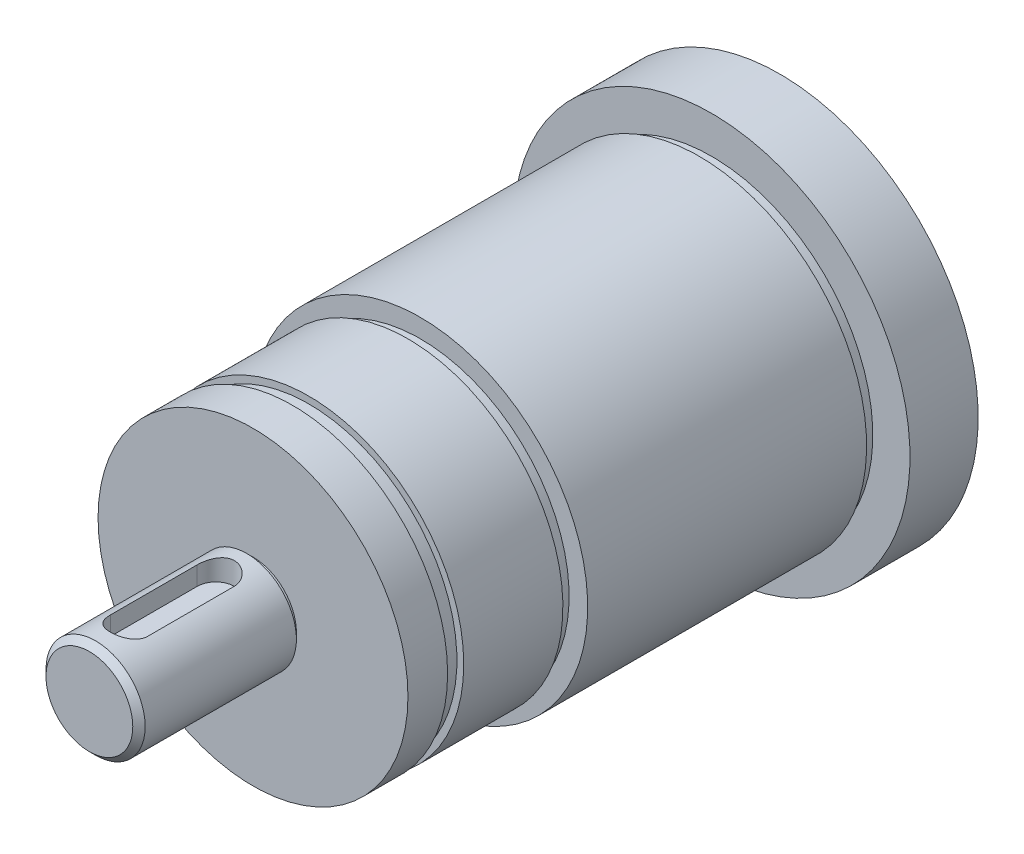
from build123d import *

# Parameters (mm, degrees)
CHAMFER_1_SIZE      = 0.5
CUT_EXTRUDE_1_DEPTH = 1.8
SKETCH_3_R          = 3
CUT_EXTRUDE_2_DEPTH = 2
SKETCH_4_W          = 1.25
SKETCH_4_H          = 0.3
CHAMFER_2_SIZE      = 0.5
SKETCH_5_W          = 0.5
SKETCH_5_H          = 0.5


with BuildPart() as part:
    # 草图1 → 旋转1 (revolve)
    with BuildSketch(Plane(origin=(0, 0, 0), x_dir=(0, 0, -1), z_dir=(1, 0, 0))):
        Polygon((0, 0), (0, 16), (-5.5, 16), (-5.5, 13), (-6, 13), (-6, 13.5), (-29, 13.5), (-29, 12), (-29.5, 12), (-29.5, 12.5), (-38, 12.5), (-38, 11.95), (-39.3, 11.95), (-39.3, 12.5), (-42.5, 12.5), (-42.5, 3.5), (-43, 3.5), (-43, 4), (-55.7, 4), (-55.7, 0), align=None)
    revolve(axis=Axis((0, 0, 0), (0, 0, 1)))

    # 倒角1
    chamfer_1_edges = [part.edges().sort_by_distance(p)[0] for p in [
        (0, -4, 55.7),
    ]]
    chamfer(chamfer_1_edges, length=CHAMFER_1_SIZE)

    # 草图2 → 切除-拉伸1 (cut)
    with BuildSketch(Plane(origin=(0, 4, 0), x_dir=(1, 0, 0), z_dir=(0, 1, 0))):
        with BuildLine():
            Line((-1.5, -52.5), (-1.5, -45.5))
            ThreePointArc((-1.5, -45.5), (0, -44), (1.5, -45.5))
            Line((1.5, -45.5), (1.5, -52.5))
            ThreePointArc((1.5, -52.5), (0, -54), (-1.5, -52.5))
        make_face()
    extrude(amount=-CUT_EXTRUDE_1_DEPTH, mode=Mode.SUBTRACT)

    # 草图3 → 切除-拉伸2 (cut)
    with BuildSketch(Plane(origin=(0, 0, 0), x_dir=(-1, 0, 0), z_dir=(0, 0, -1))):
        Circle(SKETCH_3_R)
    extrude(amount=-CUT_EXTRUDE_2_DEPTH, mode=Mode.SUBTRACT)

    # 草图4 → 切除-旋转1 (revolve, cut)
    with BuildSketch(Plane(origin=(0, 0, 0), x_dir=(0, 0, -1), z_dir=(1, 0, 0))):
        with Locations((-53.825, -3.85)):
            Rectangle(SKETCH_4_W, SKETCH_4_H)
    revolve(axis=Axis((0, -4, 53.2), (0, 1, 0)), mode=Mode.SUBTRACT)

    # 倒角2
    chamfer_2_edges = [part.edges().sort_by_distance(p)[0] for p in [
        (3, 0, 0),
    ]]
    chamfer(chamfer_2_edges, length=CHAMFER_2_SIZE)

    # 草图5 → 切除-旋转2 (revolve, cut)
    with BuildSketch(Plane(origin=(0, 0, 0), x_dir=(0, 0, -1), z_dir=(1, 0, 0))):
        with Locations((-29.75, 12.25)):
            Rectangle(SKETCH_5_W, SKETCH_5_H)
        with Locations((-6.25, 13.25)):
            Rectangle(SKETCH_5_W, SKETCH_5_H)
    revolve(axis=Axis((0, 0, 55.7), (0, 0, -1)), mode=Mode.SUBTRACT)


solid = part.part
